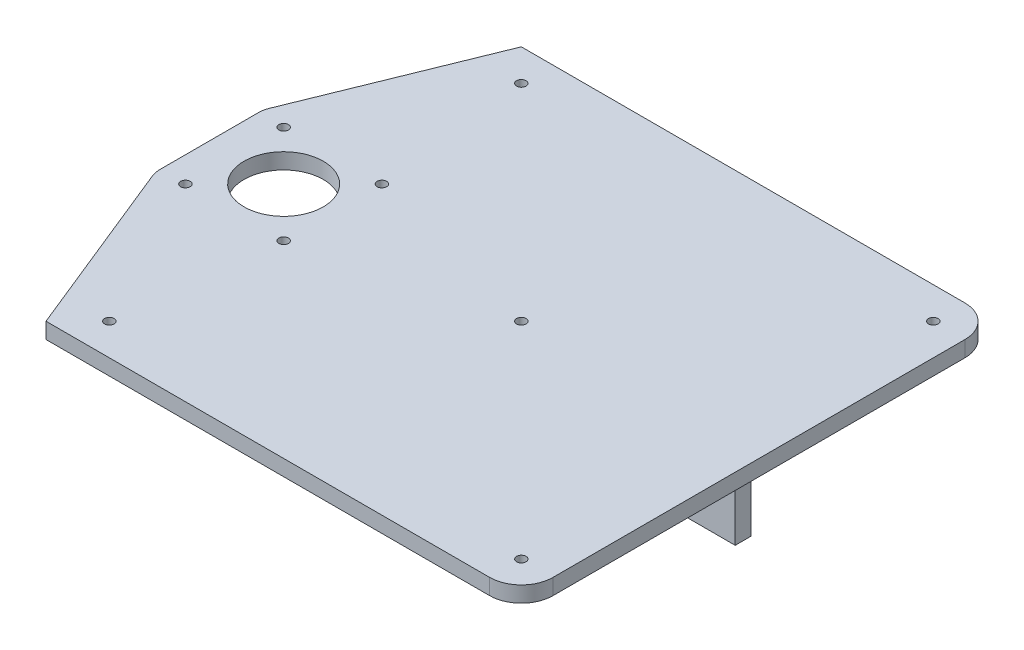
from build123d import *

# Parameters (mm, degrees)
SKETCH1_R           = 1.5
SKETCH1_R_2         = 12.5
BOSS_EXTRUDE1_DEPTH = 5
SKETCH2_W           = 20
SKETCH2_H           = 5
BOSS_EXTRUDE2_DEPTH = 25


with BuildPart() as part:
    # Sketch1 → Boss-Extrude1 (new body)
    with BuildSketch(Plane(origin=(0, 0, 0), x_dir=(1, 0, 0), z_dir=(0, 1, 0))):
        with BuildLine():
            Line((-75, -75), (65, -75))
            ThreePointArc((65, -75), (72.071067812, -72.071067812), (75, -65))
            Line((75, -65), (75, 65))
            ThreePointArc((75, 65), (72.071067812, 72.071067812), (65, 75))
            Line((65, 75), (-75, 75))
            Line((-75, 75), (-97.913420794, 18.506857518))
            ThreePointArc((-97.913420794, 18.506857518), (-98.351985938, 17.031769181), (-98.5, 15.5))
            Line((-98.5, 15.5), (-98.5, -15.5))
            ThreePointArc((-98.5, -15.5), (-98.351985938, -17.031769181), (-97.913420794, -18.506857518))
            Line((-97.913420794, -18.506857518), (-75, -75))
        make_face()
        with Locations(Location((-90.5, 15.5, 0), (0, 0, 270))):
            Circle(SKETCH1_R, mode=Mode.SUBTRACT)
        with Locations(Location((-90.5, -15.5, 0), (0, 0, 270))):
            Circle(SKETCH1_R, mode=Mode.SUBTRACT)
        with Locations(Location((-59.5, -15.5, 0), (0, 0, 270))):
            Circle(SKETCH1_R, mode=Mode.SUBTRACT)
        with Locations(Location((-59.5, 15.5, 0), (0, 0, 270))):
            Circle(SKETCH1_R, mode=Mode.SUBTRACT)
        with Locations(Location((-75, 0, 0), (0, 0, 270))):
            Circle(SKETCH1_R_2, mode=Mode.SUBTRACT)
        with Locations(Location((-65, 65, 0), (0, 0, 270))):
            Circle(SKETCH1_R, mode=Mode.SUBTRACT)
        with Locations(Location((65, 65, 0), (0, 0, 270))):
            Circle(SKETCH1_R, mode=Mode.SUBTRACT)
        with Locations(Location((65, -65, 0), (0, 0, 270))):
            Circle(SKETCH1_R, mode=Mode.SUBTRACT)
        with Locations(Location((-65, -65, 0), (0, 0, 270))):
            Circle(SKETCH1_R, mode=Mode.SUBTRACT)
        with Locations(Location((0, 0, 0), (0, 0, 270))):
            Circle(SKETCH1_R, mode=Mode.SUBTRACT)
    extrude(amount=BOSS_EXTRUDE1_DEPTH)

    # Sketch2 → Boss-Extrude2 (add)
    with BuildSketch(Plane(origin=(0, 5, 0), x_dir=(1, 0, 0), z_dir=(0, 1, 0))):
        with Locations((60, 0)):
            Rectangle(SKETCH2_W, SKETCH2_H)
    extrude(amount=-BOSS_EXTRUDE2_DEPTH)


solid = part.part
